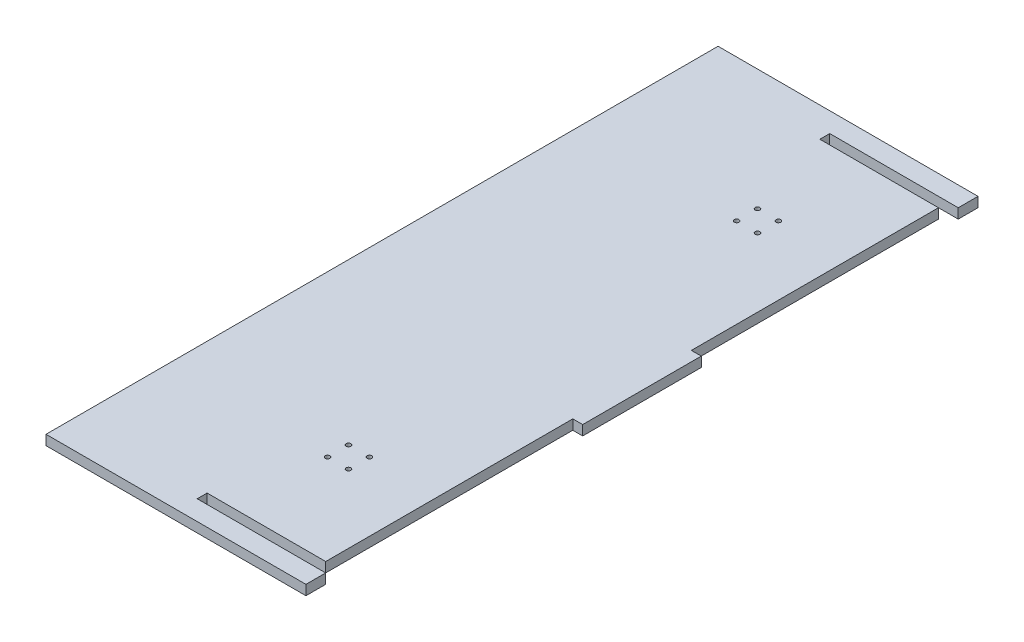
from build123d import *

# Parameters (mm, degrees)
SKETCH2_W           = 167.005
SKETCH2_H           = 431.8
BOSS_EXTRUDE2_DEPTH = 3.175
SKETCH3_W           = 6.35
SKETCH3_H           = 393.7
CUT_EXTRUDE1_DEPTH  = 232.572450879
SKETCH6_R           = 1.5
CUT_EXTRUDE3_DEPTH  = 232.572450879
SKETCH7_W           = 82.55
SKETCH7_H           = 6.35
CUT_EXTRUDE4_DEPTH  = 232.572450879
SKETCH8_W           = 6.35
SKETCH8_H           = 76.2
BOSS_EXTRUDE3_DEPTH = 6.35


with BuildPart() as part:
    # Sketch2 → Boss-Extrude2 (new, symmetric)
    with BuildSketch(Plane(origin=(0, 0, 0), x_dir=(1, 0, 0), z_dir=(0, 1, 0))):
        Rectangle(SKETCH2_W, SKETCH2_H)
    extrude(amount=BOSS_EXTRUDE2_DEPTH, both=True)

    # Sketch3 → Cut-Extrude1 (cut, through all)
    with BuildSketch(Plane(origin=(0, 3.175, 0), x_dir=(1, 0, 0), z_dir=(0, 1, 0))):
        with Locations((80.3275, 0)):
            Rectangle(SKETCH3_W, SKETCH3_H)
    extrude(amount=-CUT_EXTRUDE1_DEPTH, mode=Mode.SUBTRACT)

    # Sketch6 → Cut-Extrude3 (cut, through all)
    with BuildSketch(Plane(origin=(0, 3.175, 0), x_dir=(1, 0, 0), z_dir=(0, 1, 0))):
        with Locations(Location((19.634985579, -124.677471157, 0), (0, 0, 270))):
            Circle(SKETCH6_R)
        with Locations(Location((19.634985579, -138.1125, 0), (0, 0, 270))):
            Circle(SKETCH6_R)
        with Locations(Location((33.070014421, -124.677471157, 0), (0, 0, 270))):
            Circle(SKETCH6_R)
        with Locations(Location((33.070014421, -138.1125, 0), (0, 0, 270))):
            Circle(SKETCH6_R)
    cut_extrude3 = extrude(amount=-CUT_EXTRUDE3_DEPTH, mode=Mode.SUBTRACT)

    # Mirror1: Cut-Extrude3 across plane
    add(cut_extrude3.mirror(Plane.XY), mode=Mode.SUBTRACT)

    # Sketch7 → Cut-Extrude4 (cut, through all)
    with BuildSketch(Plane(origin=(0, 3.175, 0), x_dir=(1, 0, 0), z_dir=(0, 1, 0))):
        with Locations((42.2275, 200.025)):
            Rectangle(SKETCH7_W, SKETCH7_H)
        with Locations((42.2275, -200.025)):
            Rectangle(SKETCH7_W, SKETCH7_H)
    extrude(amount=-CUT_EXTRUDE4_DEPTH, mode=Mode.SUBTRACT)

    # Sketch8 → Boss-Extrude3 (add)
    with BuildSketch(Plane(origin=(0, 3.175, 0), x_dir=(1, 0, 0), z_dir=(0, 1, 0))):
        with Locations((80.3275, 0)):
            Rectangle(SKETCH8_W, SKETCH8_H)
    extrude(amount=-BOSS_EXTRUDE3_DEPTH)


solid = part.part
